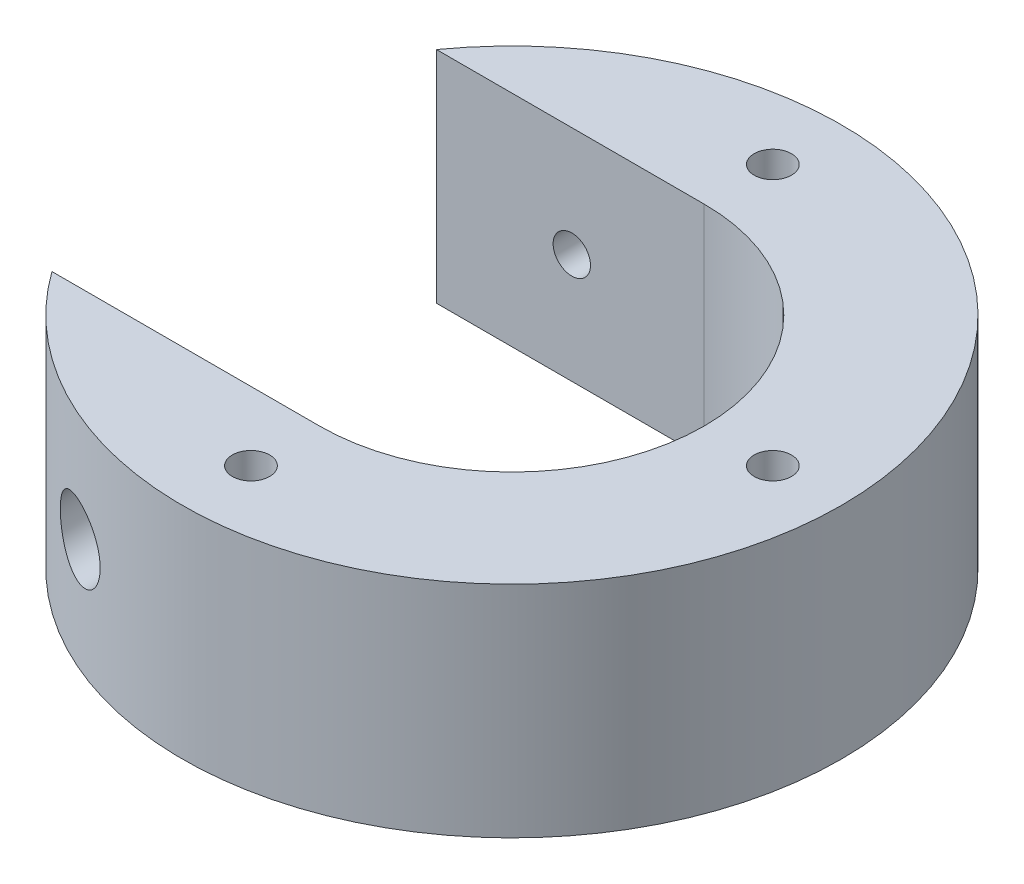
from build123d import *

# Parameters (mm, degrees)
SKETCH2_R                      = 30
BOSS_EXTRUDE1_DEPTH            = 20
CUT_EXTRUDE2_DEPTH             = 47.904157598
M3_CLEARANCE_HOLE1_D           = 3.4
M3_CLEARANCE_HOLE1_CSINK_D     = 3.45
M3_CLEARANCE_HOLE1_CSINK_ANGLE = 90
CUT_EXTRUDE3_DEPTH             = 47.904157598


with BuildPart() as part:
    # Sketch2 → Boss-Extrude1 (new body)
    with BuildSketch(Plane(origin=(0, 0, 0), x_dir=(1, 0, 0), z_dir=(0, 1, 0))):
        with Locations(Location((0, 0, 0), (0, 0, 270))):
            Circle(SKETCH2_R)
    extrude(amount=BOSS_EXTRUDE1_DEPTH)

    # Sketch3 → Cut-Extrude2 (cut, through all)
    with BuildSketch(Plane(origin=(0, 20, 0), x_dir=(1, 0, 0), z_dir=(0, 1, 0))):
        with BuildLine():
            ThreePointArc((0, -17.5), (17.5, 0), (0, 17.5))
            Line((0, 17.5), (-2, 17.5))
            Line((-2, 17.5), (-2, 9.06190379))
            Line((-2, 9.06190379), (-2, 6.812488532))
            ThreePointArc((-2, 6.812488532), (-7.1, 0), (-2, -6.812488532))
            Line((-2, -6.812488532), (-2, -9.06190379))
            Line((-2, -9.06190379), (-2, -17.5))
            Line((-2, -17.5), (0, -17.5))
        make_face()
    extrude(amount=-CUT_EXTRUDE2_DEPTH, mode=Mode.SUBTRACT)

    # M3 Clearance Hole1 (through all)
    with Locations(Plane(origin=(0, 0, 0), x_dir=(-1, 0, 0), z_dir=(0, -1, 0))):
        with Locations((0, 23.75), (-23.75, 0), (0, -23.75)):
            CounterSinkHole(M3_CLEARANCE_HOLE1_D / 2, M3_CLEARANCE_HOLE1_CSINK_D / 2, counter_sink_angle=M3_CLEARANCE_HOLE1_CSINK_ANGLE)

    # Sketch6 → Cut-Extrude3 (cut, through all)
    with BuildSketch(Plane(origin=(0, 20, 0), x_dir=(1, 0, 0), z_dir=(0, 1, 0))):
        with BuildLine():
            Line((-24.366985862, 17.5), (-2, 17.5))
            Line((-2, 17.5), (-2, -17.5))
            Line((-2, -17.5), (-24.366985862, -17.5))
            ThreePointArc((-24.366985862, -17.5), (-30, 0), (-24.366985862, 17.5))
        make_face()
    extrude(amount=-CUT_EXTRUDE3_DEPTH, mode=Mode.SUBTRACT)

    # Sketch8 → CBORE for M3 SHCS1 (revolve, cut)
    with BuildSketch(Plane(origin=(-12.046985862, 10, 30), x_dir=(0, -1, 0), z_dir=(1, 0, 0))):
        Polygon((0, 0), (0, 12.5), (1.7, 12.5), (1.7, 7), (3.25, 7), (3.25, 0.025), (3.275, 0), align=None)
    cbore_for_m3_shcs1 = revolve(axis=Axis((-12.046985862, 10, 36.35), (0, 0, -1)), mode=Mode.SUBTRACT)

    # Mirror1: CBORE for M3 SHCS1 across plane
    add(cbore_for_m3_shcs1.mirror(Plane.XY), mode=Mode.SUBTRACT)


solid = part.part
